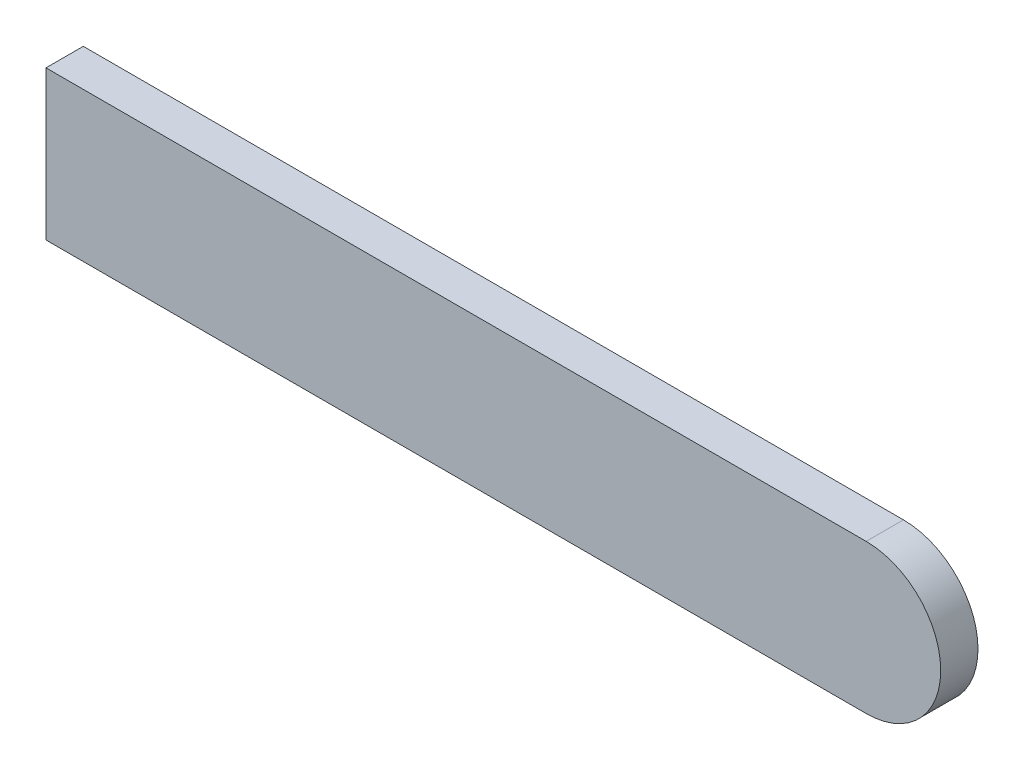
from build123d import *

# Parameters (mm, degrees)
BOSS_EXTRUDE1_DEPTH = 5


with BuildPart() as part:
    # Sketch1 → Boss-Extrude1 (new body)
    with BuildSketch(Plane.XY):
        with BuildLine():
            Line((-35, 10), (75, 10))
            ThreePointArc((75, 10), (85, 0), (75, -10))
            Line((75, -10), (-35, -10))
            Line((-35, -10), (-35, 10))
        make_face()
    extrude(amount=BOSS_EXTRUDE1_DEPTH)


solid = part.part
